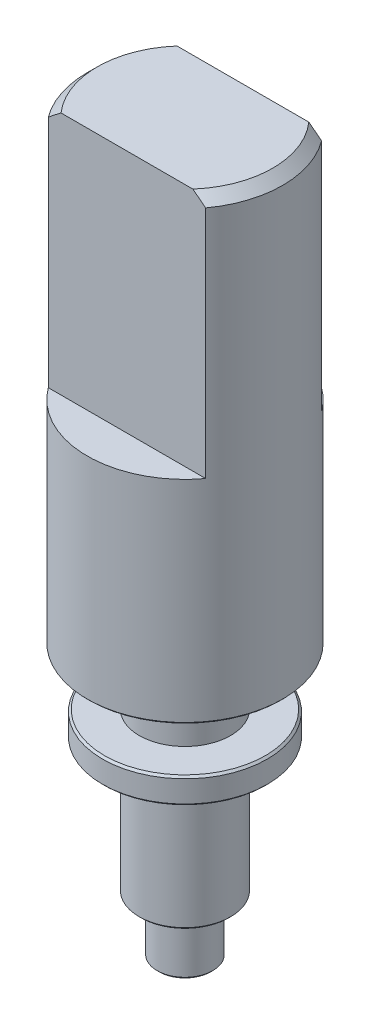
from build123d import *

# Parameters (mm, degrees)
CUT_EXTRUDE_1_DEPTH = 6.15
CHAMFER_1_SIZE      = 0.25
CHAMFER_2_SIZE      = 0.05


with BuildPart() as part:
    # Эскиз1 → Повернуть1 (revolve)
    with BuildSketch(Plane.XY, mode=Mode.PRIVATE) as revolve_1_sk:
        Polygon((0, 18.3), (0, 0), (-0.7, 0), (-0.7, 1.4), (-1.15, 1.4), (-1.15, 4.75), (-2.075, 4.75), (-2.075, 5.4), (-1.15, 5.4), (-1.15, 6.8), (-2.46, 6.8), (-2.46, 18.3), align=None)
    revolve(revolve_1_sk.sketch.rotate(Axis((0, 18.3, 0), (0, -1, 0)), 270), axis=Axis((0, 18.3, 0), (0, -1, 0)))

    # Эскиз2 → Вырез-Вытянуть1 (cut)
    with BuildSketch(Plane(origin=(0, 18.3, 0), x_dir=(1, 0, 0), z_dir=(0, 1, 0))):
        with BuildLine():
            Line((-1.979898987, 1.46), (1.979898987, 1.46))
            ThreePointArc((1.979898987, 1.46), (0, 2.46), (-1.979898987, 1.46))
        make_face()
        with BuildLine():
            Line((-1.979898987, -1.46), (1.979898987, -1.46))
            ThreePointArc((1.979898987, -1.46), (0, -2.46), (-1.979898987, -1.46))
        make_face()
    extrude(amount=-CUT_EXTRUDE_1_DEPTH, mode=Mode.SUBTRACT)

    # Фаска1
    chamfer_1_edges = [part.edges().sort_by_distance(p)[0] for p in [
        (-2.46, 18.3, 0),
        (2.46, 18.3, 0),
    ]]
    chamfer(chamfer_1_edges, length=CHAMFER_1_SIZE)

    # Фаска2
    chamfer_2_edges = [part.edges().sort_by_distance(p)[0] for p in [
        (0, 5.4, -2.075),
        (0, 4.75, -2.075),
        (0, 1.4, -1.15),
        (0, 0, -0.7),
        (0, 6.8, -2.46),
    ]]
    chamfer(chamfer_2_edges, length=CHAMFER_2_SIZE)


solid = part.part
